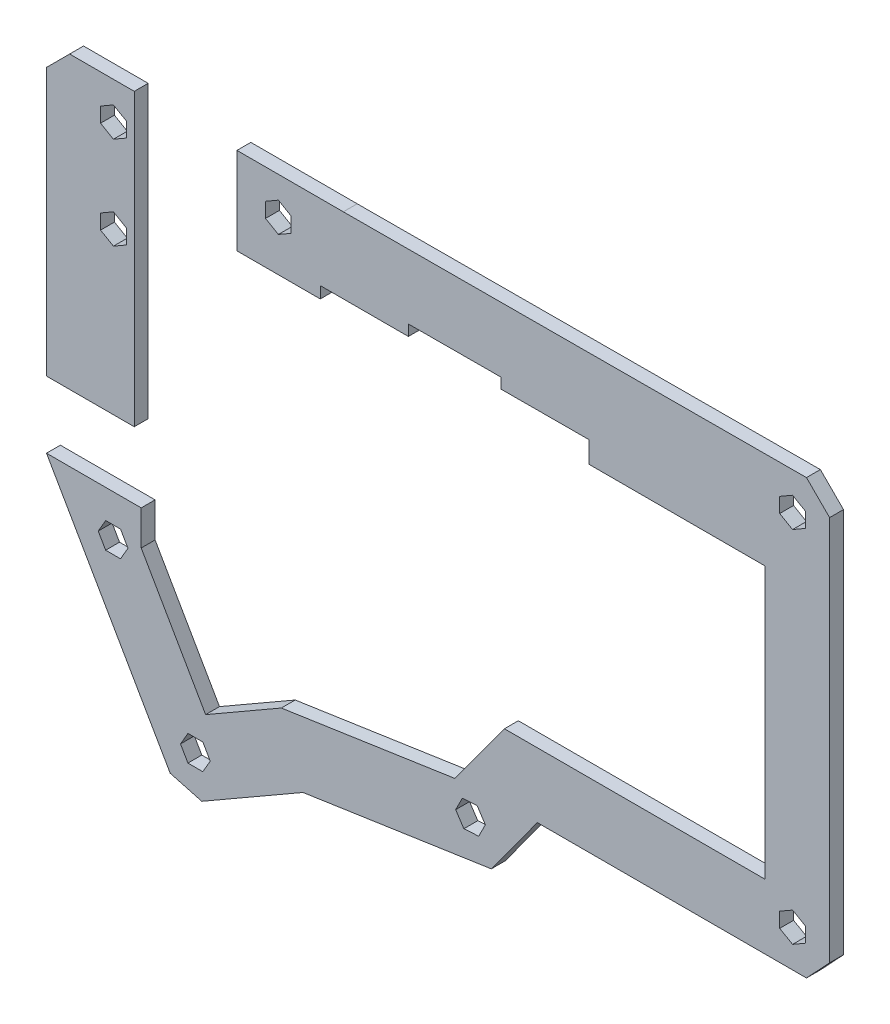
from build123d import *

# Parameters (mm, degrees)
BOSS_EXTRU_1_DEPTH   = 3
BOSS_EXTRU_1_2_DEPTH = 3


with BuildPart() as part:
    # Esquisse1 → Boss.-Extru.1 (new body)
    with BuildSketch(Plane.XY):
        Polygon((-160.478985875, -70.841138967), (-133.761270027, -117.344044002), (-126.936961278, -119.18521524), (-105.07834936, -106.603969177), (-64.409664562, -100.558603138), (-54.463628843, -86.933633781), (3.660893039, -86.933633781), (8.660893039, -81.591018051), (8.660893039, 1.682344915), (3.660915982, 6.667197989), (-96.368661727, 6.364168479), (-103.365175584, 6.364168479), (-119.345597764, 6.364168479), (-119.345597764, 1.542908687), (-119.346382005, -12.429484403), (-101.345774335, -12.429484403), (-101.345774335, -9.929307079), (-82.318329451, -9.929307079), (-82.325535908, -7.59335353), (-62.324350924, -7.532761958), (-62.31741501, -9.781019755), (-43.341802282, -9.722479661), (-43.341802282, -14.337028264), (-5.339106961, -14.337028264), (-5.339106961, -72.933633781), (-61.577157206, -72.933633781), (-72.263087593, -87.572177036), (-109.761976756, -93.1463556), (-126.111124489, -102.556497988), (-140.02282508, -78.342807898), (-140.02282508, -70.841138967), align=None)
        Polygon((-110.397084988, -4.888433419), (-107.617084988, -3.283399671), (-107.617084988, -0.073332174), (-110.397084988, 1.531701574), (-113.177084988, -0.073332174), (-113.177084988, -3.283399671), align=None, mode=Mode.SUBTRACT)
        Polygon((0.660893039, -4.551994484), (3.440893039, -2.946960735), (3.440893039, 0.263106761), (0.660893039, 1.86814051), (-2.119106961, 0.263106761), (-2.119106961, -2.946960735), align=None, mode=Mode.SUBTRACT)
        Polygon((0.660893039, -75.723566285), (-2.119106961, -77.328600033), (-2.119106961, -80.53866753), (0.660893039, -82.143701278), (3.440893039, -80.53866753), (3.440893039, -77.328600033), align=None, mode=Mode.SUBTRACT)
        Polygon((-70.666109178, -90.458987975), (-72.101631087, -93.330191587), (-70.332856775, -96.008991835), (-67.128560553, -95.81658847), (-65.693038643, -92.945384858), (-67.461812956, -90.266584611), align=None, mode=Mode.SUBTRACT)
        Polygon((-129.921410961, -107.968661897), (-131.53231051, -110.745267014), (-129.933149717, -113.528649505), (-126.723089375, -113.535426879), (-125.112189826, -110.758821762), (-126.711350619, -107.975439271), align=None, mode=Mode.SUBTRACT)
        Polygon((-144.493218107, -82.606038544), (-142.882318558, -79.829433427), (-144.481479351, -77.046050936), (-147.691539693, -77.039273562), (-149.302439242, -79.815878679), (-147.703278449, -82.59926117), align=None, mode=Mode.SUBTRACT)
    extrude(amount=BOSS_EXTRU_1_DEPTH)


with BuildPart() as body_2:
    # Esquisse1 → Boss.-Extru.1 2 (new body)
    with BuildSketch(Plane.XY):
        Polygon((-160.478985875, -3.429484403), (-160.478985875, -56.420747812), (-141.52282508, -56.420747812), (-141.52282508, 1.570515597), (-141.52282508, 6.320852512), (-155.478985875, 6.320852512), (-160.478985875, 1.320852512), align=None)
        Polygon((-146.02282508, -18.467800689), (-148.80282508, -20.072834437), (-148.80282508, -23.282901934), (-146.02282508, -24.887935682), (-143.24282508, -23.282901934), (-143.24282508, -20.072834437), align=None, mode=Mode.SUBTRACT)
        Polygon((-146.02282508, -4.887935682), (-143.24282508, -3.282901934), (-143.24282508, -0.072834437), (-146.02282508, 1.532199311), (-148.80282508, -0.072834437), (-148.80282508, -3.282901934), align=None, mode=Mode.SUBTRACT)
    extrude(amount=BOSS_EXTRU_1_2_DEPTH)


solid = Compound([part.part, body_2.part])
